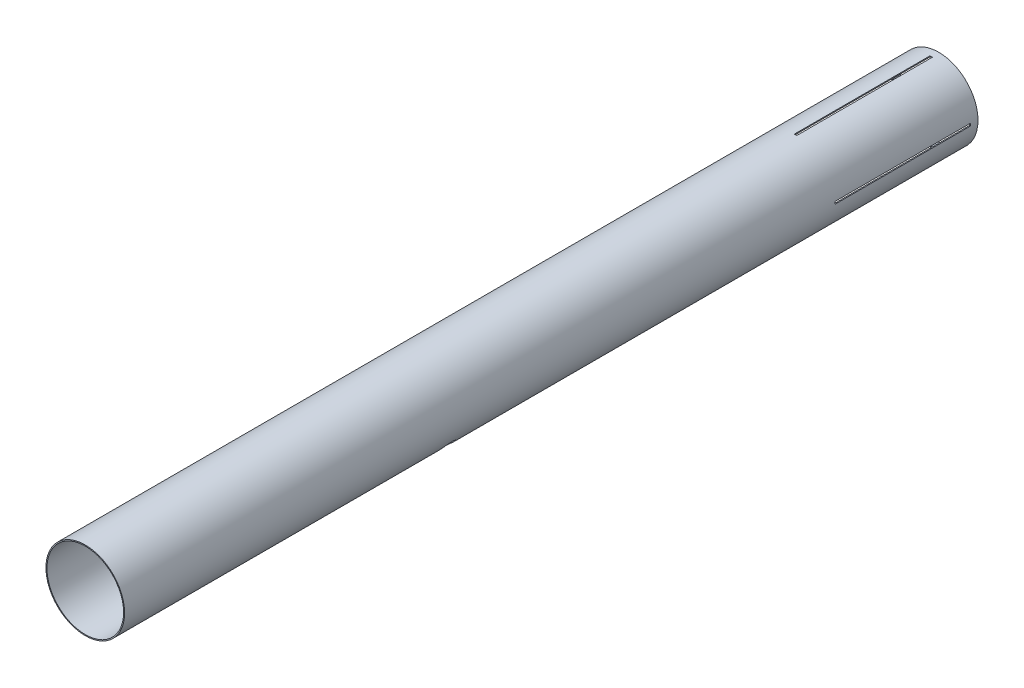
from build123d import *

# Parameters (mm, degrees)
SKETCH1_R           = 78.35
SKETCH1_R_2         = 76.35
BOSS_EXTRUDE1_DEPTH = 1700
SKETCH5_R           = 15
CUT_EXTRUDE2_DEPTH  = 1704.607186237
SKETCH6_W           = 4.8
SKETCH6_H           = 270
CUT_EXTRUDE3_DEPTH  = 1704.607186346
CIRPATTERN1_COUNT   = 2
CIRPATTERN1_ANGLE   = 90


with BuildPart() as part:
    # Sketch1 → Boss-Extrude1 (new body)
    with BuildSketch(Plane.XY):
        Circle(SKETCH1_R)
        Circle(SKETCH1_R_2, mode=Mode.SUBTRACT)
    extrude(amount=BOSS_EXTRUDE1_DEPTH)

    # Sketch5 → Cut-Extrude2 (cut, through all)
    with BuildSketch(Plane(origin=(0, 0, 0), x_dir=(0, 0, -1), z_dir=(0.7071067811865489, -0.7071067811865462, 0))):
        with Locations(Location((-1034.89, 0, 0), (0, 0, 270))):
            Circle(SKETCH5_R)
    extrude(amount=CUT_EXTRUDE2_DEPTH, mode=Mode.SUBTRACT)

    # Sketch6 → Cut-Extrude3 (cut, symmetric)
    with BuildSketch(Plane(origin=(0, 0, 0), x_dir=(1, 0, 0), z_dir=(0, 1, 0))):
        with Locations((0, -150)):
            Rectangle(SKETCH6_W, SKETCH6_H)
    cut_extrude3 = extrude(amount=CUT_EXTRUDE3_DEPTH, both=True, mode=Mode.SUBTRACT)

    # CirPattern1: Cut-Extrude3 ×2 about axis
    cirpattern1_axis = Axis((0, 0, 0), (0, 0, 1))
    for i in range(1, CIRPATTERN1_COUNT):
        add(cut_extrude3.rotate(cirpattern1_axis, i * CIRPATTERN1_ANGLE / (CIRPATTERN1_COUNT - 1)), mode=Mode.SUBTRACT)


solid = part.part
